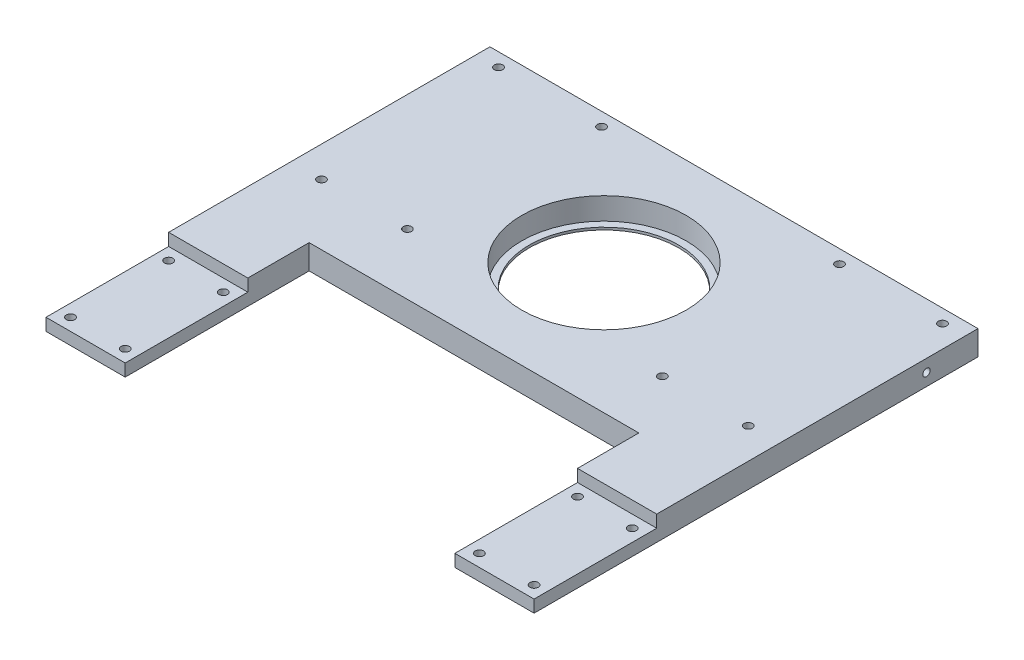
from build123d import *

# Parameters (mm, degrees)
SKIZZE1_W                        = 199
SKIZZE1_H                        = 420
AUFSATZ_LINEAR_AUSTRAGEN1_DEPTH  = 10
SKIZZE5_W                        = 199
SKIZZE5_H                        = 85
SCHNITT_LINEAR_AUSTRAGEN2_DEPTH  = 10
SKIZZE6_R                        = 1.7
SCHNITT_LINEAR_AUSTRAGEN3_DEPTH  = 233.594604409
SCHNITT_LINEAR_AUSTRAGEN4_DEPTH  = 4
SKIZZE16_W                       = 35
SKIZZE16_H                       = 7
SCHNITT_LINEAR_AUSTRAGEN10_DEPTH = 5
SCHNITT_LINEAR_AUSTRAGEN11_DEPTH = 35
SKIZZE20_R                       = 1.7
SCHNITT_LINEAR_AUSTRAGEN12_DEPTH = 233.594604409
SKIZZE21_W                       = 134.422077922
SKIZZE21_H                       = 75
SCHNITT_LINEAR_AUSTRAGEN13_DEPTH = 233.594604409
SCHNITT_LINEAR_AUSTRAGEN14_DEPTH = 233.594604409
AUFSATZ_LINEAR_AUSTRAGEN6_DEPTH  = 10
SKIZZE25_R                       = 1.7
SCHNITT_LINEAR_AUSTRAGEN15_DEPTH = 233.594604409
SCHNITT_LINEAR_AUSTRAGEN16_DEPTH = 290.484023739
SKIZZE27_R                       = 33.5
SCHNITT_LINEAR_AUSTRAGEN17_DEPTH = 161.078886803
SKIZZE28_R                       = 36.006256149
SKIZZE28_R_2                     = 30.5
AUFSATZ_LINEAR_AUSTRAGEN7_DEPTH  = 1
SKIZZE29_R                       = 1.5
SCHNITT_LINEAR_AUSTRAGEN18_DEPTH = 10
SKIZZE30_R                       = 1.5
SCHNITT_LINEAR_AUSTRAGEN19_DEPTH = 10
SKIZZE31_R                       = 2.95
SCHNITT_LINEAR_AUSTRAGEN20_DEPTH = 3.5


with BuildPart() as part:
    # Skizze1 → Aufsatz-Linear austragen1 (new body)
    with BuildSketch(Plane(origin=(0, 0, 0), x_dir=(1, 0, 0), z_dir=(0, 1, 0))):
        Rectangle(SKIZZE1_W, SKIZZE1_H)
    extrude(amount=AUFSATZ_LINEAR_AUSTRAGEN1_DEPTH)

    # Skizze5 → Schnitt-Linear austragen2 (cut)
    with BuildSketch(Plane(origin=(0, 10, 0), x_dir=(1, 0, 0), z_dir=(0, 1, 0))):
        Polygon((99.5, -210), (18, -210), (99.5, -56), align=None)
        Polygon((-18, -210), (-99.5, -56), (-99.5, -210), align=None)
        with Locations((0, 167.5)):
            Rectangle(SKIZZE5_W, SKIZZE5_H)
        Polygon((67.211038961, -56), (-67.211038961, -56), (-2.646103896, -178), (2.646103896, -178), align=None)
    extrude(amount=-SCHNITT_LINEAR_AUSTRAGEN2_DEPTH, mode=Mode.SUBTRACT)

    # Skizze6 → Schnitt-Linear austragen3 (cut, through all)
    with BuildSketch(Plane(origin=(0, 10, 0), x_dir=(1, 0, 0), z_dir=(0, 1, 0))):
        with Locations(Location((-11, -205, 0), (0, 0, 270))):
            Circle(SKIZZE6_R)
        with Locations(Location((-11, -188.18, 0), (0, 0, 90))):
            Circle(SKIZZE6_R)
        with Locations(Location((11, -205, 0), (0, 0, 90))):
            Circle(SKIZZE6_R)
        with Locations(Location((11, -188.18, 0), (0, 0, 270))):
            Circle(SKIZZE6_R)
    extrude(amount=-SCHNITT_LINEAR_AUSTRAGEN3_DEPTH, mode=Mode.SUBTRACT)

    # Skizze7 → Schnitt-Linear austragen4 (cut)
    with BuildSketch(Plane.XZ):
        Polygon((-11, 208.406366588), (-8.05, 206.703183294), (-8.05, 203.296816706), (-11, 201.593633412), (-13.95, 203.296816706), (-13.95, 206.703183294), align=None)
        Polygon((11, 208.406366588), (8.05, 206.703183294), (8.05, 203.296816706), (11, 201.593633412), (13.95, 203.296816706), (13.95, 206.703183294), align=None)
        Polygon((-8.05, 186.476816706), (-8.05, 189.883183294), (-11, 191.586366588), (-13.95, 189.883183294), (-13.95, 186.476816706), (-11, 184.773633412), align=None)
        Polygon((8.05, 186.476816706), (8.05, 189.883183294), (11, 191.586366588), (13.95, 189.883183294), (13.95, 186.476816706), (11, 184.773633412), align=None)
    extrude(amount=-SCHNITT_LINEAR_AUSTRAGEN4_DEPTH, mode=Mode.SUBTRACT)

    # Skizze16 → Schnitt-Linear austragen10 (cut)
    with BuildSketch(Plane.XZ):
        with Locations((0, 196.59)):
            Rectangle(SKIZZE16_W, SKIZZE16_H)
    extrude(amount=-SCHNITT_LINEAR_AUSTRAGEN10_DEPTH, mode=Mode.SUBTRACT)

    # Skizze17 → Schnitt-Linear austragen11 (cut)
    with BuildSketch(Plane.ZY.offset(-17.5)):
        Polygon((193.09, 5), (196.59, 8.5), (200.09, 5), align=None)
    extrude(amount=SCHNITT_LINEAR_AUSTRAGEN11_DEPTH, mode=Mode.SUBTRACT)

    # Skizze20 → Schnitt-Linear austragen12 (cut, through all)
    with BuildSketch(Plane(origin=(0, 10, 0), x_dir=(1, 0, 0), z_dir=(0, 1, 0))):
        with Locations(Location((90.5, 119.52, 0), (0, 0, 270))):
            Circle(SKIZZE20_R)
        with Locations(Location((48.5, 119.52, 0), (0, 0, 270))):
            Circle(SKIZZE20_R)
        with Locations(Location((-48.5, 119.52, 0), (0, 0, 90))):
            Circle(SKIZZE20_R)
        with Locations(Location((-90.5, 119.52, 0), (0, 0, 90))):
            Circle(SKIZZE20_R)
        with Locations(Location((87, 43.82, 0), (0, 0, 270))):
            Circle(SKIZZE20_R)
        with Locations(Location((52, 43.82, 0), (0, 0, 270))):
            Circle(SKIZZE20_R)
        with Locations(Location((-87, 43.82, 0), (0, 0, 90))):
            Circle(SKIZZE20_R)
        with Locations(Location((-52, 43.82, 0), (0, 0, 90))):
            Circle(SKIZZE20_R)
    extrude(amount=-SCHNITT_LINEAR_AUSTRAGEN12_DEPTH, mode=Mode.SUBTRACT)

    # Skizze21 → Schnitt-Linear austragen13 (cut, through all)
    with BuildSketch(Plane(origin=(0, 10, 0), x_dir=(1, 0, 0), z_dir=(0, 1, 0))):
        with Locations((0, -18.5)):
            Rectangle(SKIZZE21_W, SKIZZE21_H)
    extrude(amount=-SCHNITT_LINEAR_AUSTRAGEN13_DEPTH, mode=Mode.SUBTRACT)

    # Skizze22 → Schnitt-Linear austragen14 (cut, through all)
    with BuildSketch(Plane(origin=(0, 10, 0), x_dir=(1, 0, 0), z_dir=(0, 1, 0))):
        with BuildLine():
            Line((-67.211038961, -56), (-2.646103896, -178))
            ThreePointArc((-2.646103896, -178), (-52.825886854, -126.471631215), (-67.211038961, -56))
        make_face()
    schnitt_linear_austragen14 = extrude(amount=-SCHNITT_LINEAR_AUSTRAGEN14_DEPTH, mode=Mode.SUBTRACT)

    # Skizze23 → Aufsatz-Linear austragen6 (add)
    with BuildSketch(Plane(origin=(0, 10, 0), x_dir=(1, 0, 0), z_dir=(0, 1, 0))):
        with BuildLine():
            Line((-99.5, -56), (-18, -210))
            ThreePointArc((-18, -210), (-75.095260266, -141.650251374), (-99.5, -56))
        make_face()
    aufsatz_linear_austragen6 = extrude(amount=-AUFSATZ_LINEAR_AUSTRAGEN6_DEPTH)

    # Spiegeln2: Schnitt-Linear austragen14, Aufsatz-Linear austragen6 across plane
    add(schnitt_linear_austragen14.mirror(Plane(origin=(0, 0, 0), x_dir=(0, 0, 1), z_dir=(1, 0, 0))), mode=Mode.SUBTRACT)
    add(aufsatz_linear_austragen6.mirror(Plane(origin=(0, 0, 0), x_dir=(0, 0, 1), z_dir=(1, 0, 0))))

    # Skizze25 → Schnitt-Linear austragen15 (cut, through all)
    with BuildSketch(Plane(origin=(0, 10, 0), x_dir=(1, 0, 0), z_dir=(0, 1, 0))):
        with Locations(Location((-94.5, -11, 0), (0, 0, 270))):
            Circle(SKIZZE25_R)
        with Locations(Location((-72.211038961, -11, 0), (0, 0, 90))):
            Circle(SKIZZE25_R)
        with Locations(Location((-72.211038961, -51, 0), (0, 0, 270))):
            Circle(SKIZZE25_R)
        with Locations(Location((-94.5, -51, 0), (0, 0, 90))):
            Circle(SKIZZE25_R)
    schnitt_linear_austragen15 = extrude(amount=-SCHNITT_LINEAR_AUSTRAGEN15_DEPTH, mode=Mode.SUBTRACT)

    # Spiegeln3: Schnitt-Linear austragen15 across plane
    add(schnitt_linear_austragen15.mirror(Plane(origin=(0, 0, 0), x_dir=(0, 0, 1), z_dir=(1, 0, 0))), mode=Mode.SUBTRACT)

    # Skizze26 → Schnitt-Linear austragen16 (cut, through all)
    with BuildSketch(Plane.ZY.offset(99.5)):
        Polygon((6, 5), (6, 13.101486595), (200.684563047, 82.546277137), (242.997216492, -41.037631402), (91.241487897, -60.284782055), (56, 0), (56, 5), align=None)
    extrude(amount=-SCHNITT_LINEAR_AUSTRAGEN16_DEPTH, mode=Mode.SUBTRACT)

    # Skizze27 → Schnitt-Linear austragen17 (cut, through all)
    with BuildSketch(Plane(origin=(0, 10, 0), x_dir=(1, 0, 0), z_dir=(0, 1, 0))):
        with Locations(Location((0, 72, 0), (0, 0, 270))):
            Circle(SKIZZE27_R)
    extrude(amount=-SCHNITT_LINEAR_AUSTRAGEN17_DEPTH, mode=Mode.SUBTRACT)

    # Skizze28 → Aufsatz-Linear austragen7 (add)
    with BuildSketch(Plane.XZ):
        with Locations((0, -72)):
            Circle(SKIZZE28_R)
        with Locations(Location((0, -72, 0), (0, 0, 270))):
            Circle(SKIZZE28_R_2, mode=Mode.SUBTRACT)
    extrude(amount=-AUFSATZ_LINEAR_AUSTRAGEN7_DEPTH)

    # Skizze29 → Schnitt-Linear austragen18 (cut)
    with BuildSketch(Plane.ZY.offset(99.5)):
        with Locations((-104, 5)):
            Circle(SKIZZE29_R)
    schnitt_linear_austragen18 = extrude(amount=-SCHNITT_LINEAR_AUSTRAGEN18_DEPTH, mode=Mode.SUBTRACT)

    # Skizze30 → Schnitt-Linear austragen19 (cut)
    with BuildSketch(Plane(origin=(0, 0, -125), x_dir=(-1, 0, 0), z_dir=(0, 0, -1))):
        with Locations((94.5, 5)):
            Circle(SKIZZE30_R)
        with Locations((78.5, 5)):
            Circle(SKIZZE30_R)
    schnitt_linear_austragen19 = extrude(amount=-SCHNITT_LINEAR_AUSTRAGEN19_DEPTH, mode=Mode.SUBTRACT)

    # Spiegeln4: Schnitt-Linear austragen18, Schnitt-Linear austragen19 across plane
    add(schnitt_linear_austragen18.mirror(Plane(origin=(0, 0, 0), x_dir=(0, 0, 1), z_dir=(1, 0, 0))), mode=Mode.SUBTRACT)
    add(schnitt_linear_austragen19.mirror(Plane(origin=(0, 0, 0), x_dir=(0, 0, 1), z_dir=(1, 0, 0))), mode=Mode.SUBTRACT)

    # Skizze31 → Schnitt-Linear austragen20 (cut)
    with BuildSketch(Plane.XZ):
        with Locations(Location((-90.5, -119.52, 0), (0, 0, 270))):
            Circle(SKIZZE31_R)
        with Locations(Location((-48.5, -119.52, 0), (0, 0, 270))):
            Circle(SKIZZE31_R)
        with Locations(Location((-87, -43.82, 0), (0, 0, 270))):
            Circle(SKIZZE31_R)
        with Locations(Location((-52, -43.82, 0), (0, 0, 270))):
            Circle(SKIZZE31_R)
        with Locations(Location((52, -43.82, 0), (0, 0, 90))):
            Circle(SKIZZE31_R)
        with Locations(Location((87, -43.82, 0), (0, 0, 90))):
            Circle(SKIZZE31_R)
        with Locations(Location((48.5, -119.52, 0), (0, 0, 90))):
            Circle(SKIZZE31_R)
        with Locations(Location((90.5, -119.52, 0), (0, 0, 90))):
            Circle(SKIZZE31_R)
    extrude(amount=-SCHNITT_LINEAR_AUSTRAGEN20_DEPTH, mode=Mode.SUBTRACT)


solid = part.part
